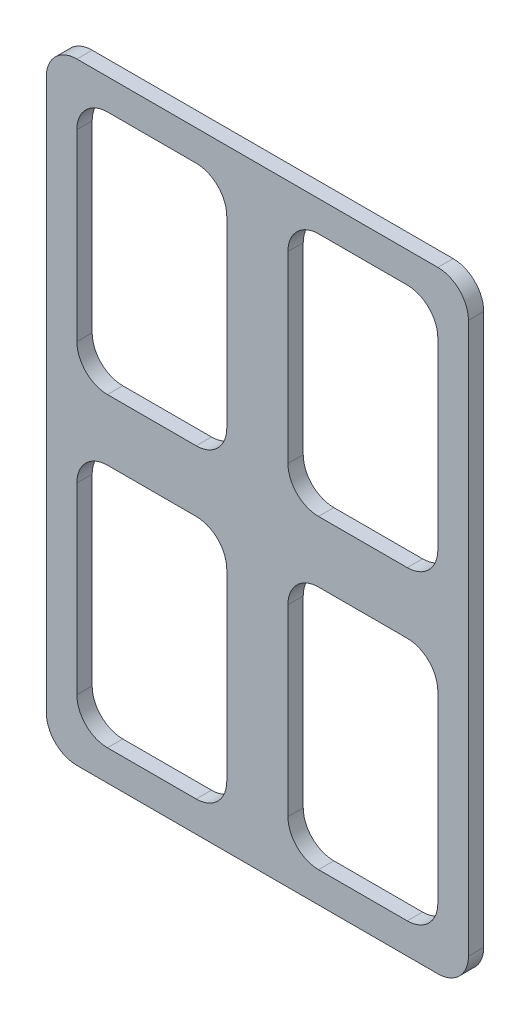
from build123d import *

# Parameters (mm, degrees)
SKETCH_1_W          = 138
SKETCH_1_H          = 200
EXTRUDE_1_DEPTH     = 5
SKETCH_2_W          = 49
SKETCH_2_H          = 80
CUT_EXTRUDE_2_DEPTH = 5
FILLET_1_R          = 10


with BuildPart() as part:
    # 草图1 → 凸台-拉伸1 (new body)
    with BuildSketch(Plane.XY):
        Rectangle(SKETCH_1_W, SKETCH_1_H)
    extrude(amount=EXTRUDE_1_DEPTH)

    # 草图2 → 切除-拉伸2 (cut)
    with BuildSketch(Plane.XY.offset(5)):
        with Locations((34.5, 50)):
            Rectangle(SKETCH_2_W, SKETCH_2_H)
        with Locations((-34.5, 50)):
            Rectangle(SKETCH_2_W, SKETCH_2_H)
        with Locations((34.5, -50)):
            Rectangle(SKETCH_2_W, SKETCH_2_H)
        with Locations((-34.5, -50)):
            Rectangle(SKETCH_2_W, SKETCH_2_H)
    extrude(amount=-CUT_EXTRUDE_2_DEPTH, mode=Mode.SUBTRACT)

    # 圆角1
    fillet_1_edges = [part.edges().sort_by_distance(p)[0] for p in [
        (-10, 90, 2.5),
        (-10, 10, 2.5),
        (-59, 10, 2.5),
        (-59, 90, 2.5),
        (10, -90, 2.5),
        (10, -10, 2.5),
        (59, -10, 2.5),
        (59, -90, 2.5),
        (-10, -90, 2.5),
        (-59, -90, 2.5),
        (-59, -10, 2.5),
        (-10, -10, 2.5),
        (10, 10, 2.5),
        (10, 90, 2.5),
        (59, 90, 2.5),
        (59, 10, 2.5),
        (-69, 100, 2.5),
        (69, 100, 2.5),
        (69, -100, 2.5),
        (-69, -100, 2.5),
    ]]
    fillet(fillet_1_edges, radius=FILLET_1_R)


solid = part.part
